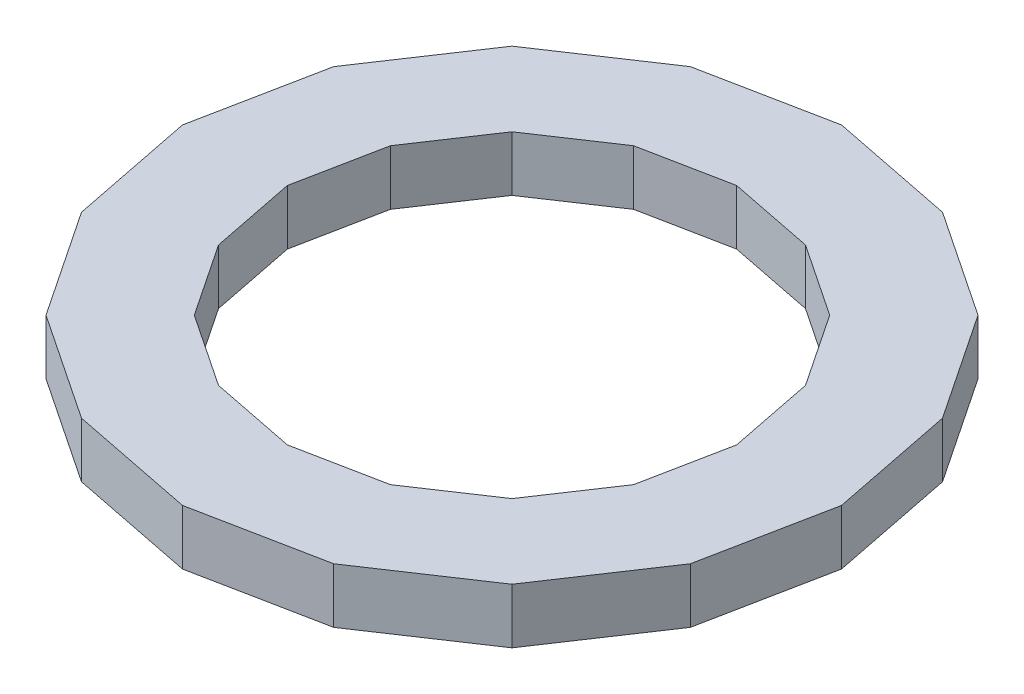
from build123d import *

# Parameters (mm, degrees)
BOSS_EXTRUDE1_DEPTH = 19.05


with BuildPart() as part:
    # Sketch1 → Boss-Extrude1 (new body)
    with BuildSketch(Plane(origin=(0, 0, 0), x_dir=(1, 0, 0), z_dir=(0, 1, 0))):
        Polygon((113.921591652, 0), (105.249826838, 43.595905714), (80.554729981, 80.554729981), (43.595905714, 105.249826838), (0, 113.921591652), (-43.595905714, 105.249826838), (-80.554729981, 80.554729981), (-105.249826838, 43.595905714), (-113.921591652, 0), (-105.249826838, -43.595905714), (-80.554729981, -80.554729981), (-43.595905714, -105.249826838), (0, -113.921591652), (43.595905714, -105.249826838), (80.554729981, -80.554729981), (105.249826838, -43.595905714), align=None)
        Polygon((77.664930066, 0), (71.753039282, 29.721082012), (54.91739871, 54.91739871), (29.721082012, 71.753039282), (0, 77.664930066), (-29.721082012, 71.753039282), (-54.91739871, 54.91739871), (-71.753039282, 29.721082012), (-77.664930066, 0), (-71.753039282, -29.721082012), (-54.91739871, -54.91739871), (-29.721082012, -71.753039282), (0, -77.664930066), (29.721082012, -71.753039282), (54.91739871, -54.91739871), (71.753039282, -29.721082012), align=None, mode=Mode.SUBTRACT)
    extrude(amount=BOSS_EXTRUDE1_DEPTH)


solid = part.part
